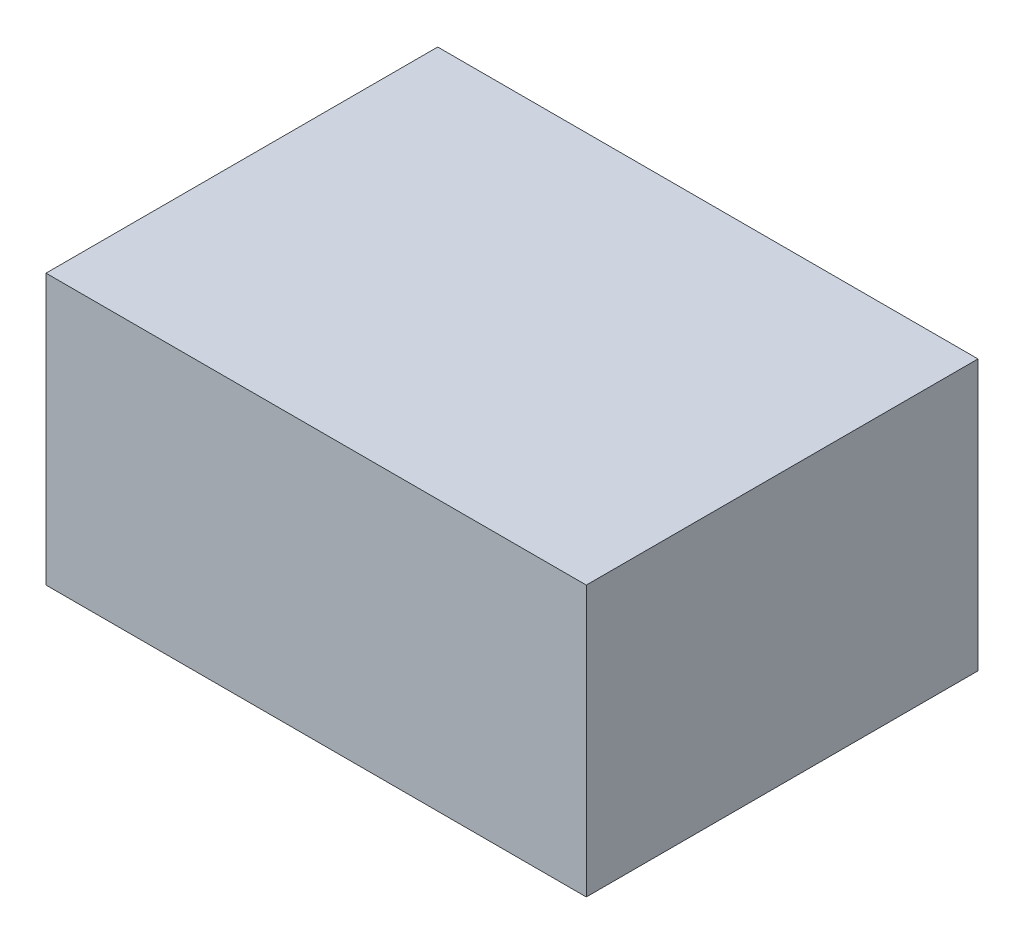
from build123d import *

# Parameters (mm, degrees)
SKETCH6_W           = 80
SKETCH6_H           = 58
BOSS_EXTRUDE1_DEPTH = 40


with BuildPart() as part:
    # Sketch6 → Boss-Extrude1 (new body)
    with BuildSketch(Plane(origin=(0, 0, 0), x_dir=(1, 0, 0), z_dir=(0, 1, 0))):
        Rectangle(SKETCH6_W, SKETCH6_H)
    extrude(amount=BOSS_EXTRUDE1_DEPTH)


solid = part.part
